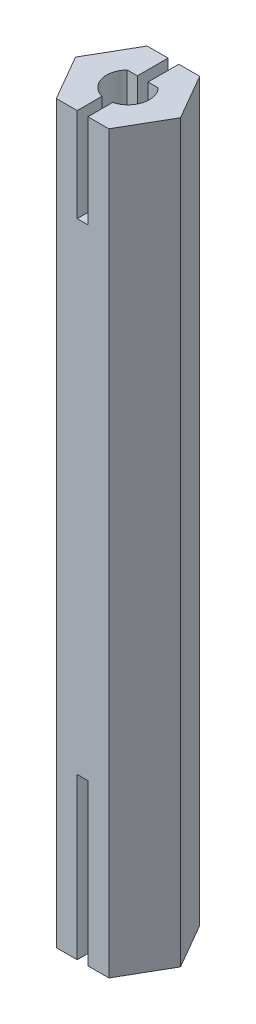
from build123d import *

# Parameters (mm, degrees)
EXTRUDE_1_DEPTH     = 55
CUT_EXTRUDE_1_DEPTH = 7
CUT_EXTRUDE_2_DEPTH = 12
SKETCH_5_R          = 1.9
CUT_EXTRUDE_3_DEPTH = 35
SKETCH_6_W          = 0.8
SKETCH_6_H          = 6.8
CUT_EXTRUDE_4_DEPTH = 7
SKETCH_7_W          = 0.8
SKETCH_7_H          = 6.8
CUT_EXTRUDE_5_DEPTH = 12


with BuildPart() as part:
    # 草图2 → 凸台-拉伸1 (new body)
    with BuildSketch(Plane(origin=(0, 0, 0), x_dir=(1, 0, 0), z_dir=(0, 1, 0))):
        Polygon((3.92598183, 0), (1.962990915, 3.4), (-1.962990915, 3.4), (-3.92598183, 0), (-1.962990915, -3.4), (1.962990915, -3.4), align=None)
    extrude(amount=EXTRUDE_1_DEPTH)

    # 草图3 → 切除-拉伸1 (cut)
    with BuildSketch(Plane(origin=(0, 55, 0), x_dir=(1, 0, 0), z_dir=(0, 1, 0))):
        with BuildLine():
            Line((1.161895004, 1.1), (-1.161895004, 1.1))
            ThreePointArc((-1.161895004, 1.1), (-0.592016889, -1.48644408), (1.6, 0))
            ThreePointArc((1.6, 0), (1.48644408, 0.592016889), (1.161895004, 1.1))
        make_face()
    extrude(amount=-CUT_EXTRUDE_1_DEPTH, mode=Mode.SUBTRACT)

    # 草图4 → 切除-拉伸2 (cut)
    with BuildSketch(Plane.XZ):
        Polygon((-1.5011107, -2.6), (1.5011107, -2.6), (3.0022214, 0), (1.5011107, 2.6), (-1.5011107, 2.6), (-3.0022214, 0), align=None)
    extrude(amount=-CUT_EXTRUDE_2_DEPTH, mode=Mode.SUBTRACT)

    # 草图5 → 切除-拉伸3 (cut)
    with BuildSketch(Plane.XZ.offset(-12)):
        with Locations(Location((0, 0, 0), (0, 0, 270))):
            Circle(SKETCH_5_R)
    extrude(amount=-CUT_EXTRUDE_3_DEPTH, mode=Mode.SUBTRACT)

    # 草图6 → 切除-拉伸4 (cut)
    with BuildSketch(Plane(origin=(0, 55, 0), x_dir=(1, 0, 0), z_dir=(0, 1, 0))):
        Rectangle(SKETCH_6_W, SKETCH_6_H)
    extrude(amount=-CUT_EXTRUDE_4_DEPTH, mode=Mode.SUBTRACT)

    # 草图7 → 切除-拉伸5 (cut)
    with BuildSketch(Plane.XZ):
        Rectangle(SKETCH_7_W, SKETCH_7_H)
    extrude(amount=-CUT_EXTRUDE_5_DEPTH, mode=Mode.SUBTRACT)


solid = part.part
